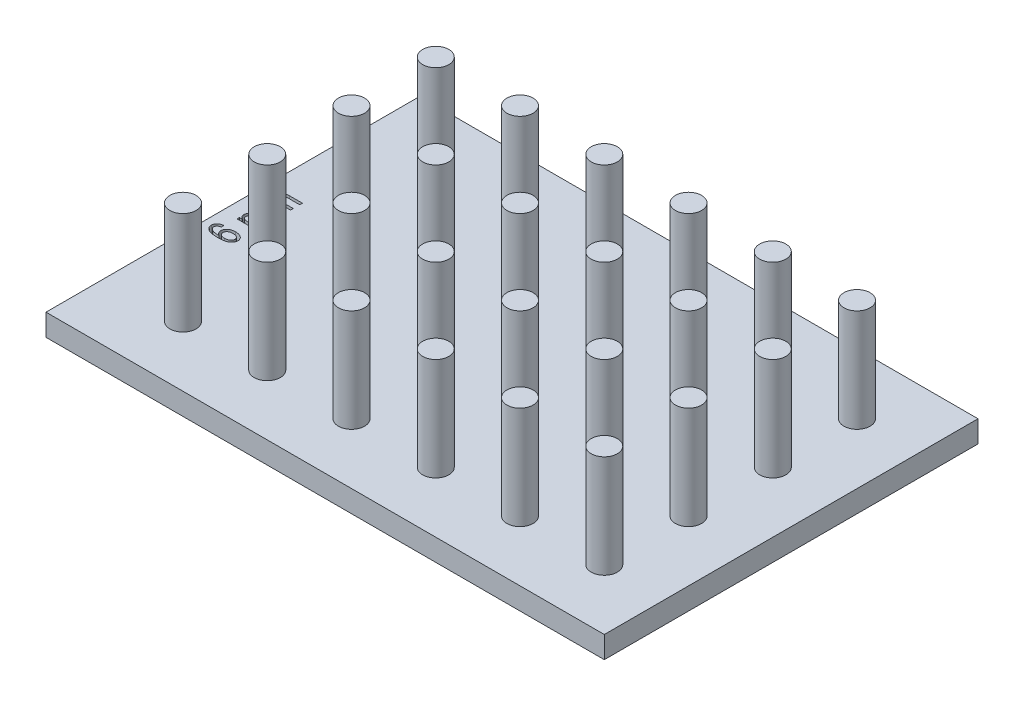
from build123d import *

# Parameters (mm, degrees)
SKETCH2_W            = 3
SKETCH2_H            = 23.5
SKETCH1_W            = 127.89
SKETCH1_H            = 85.6
BOSS_EXTRUDE2_DEPTH  = 5
LPATTERN2_COUNT      = 4
LPATTERN2_PITCH      = 19.3
LPATTERN2_COUNT_DIR2 = 6
LPATTERN2_PITCH_DIR2 = 19.3
CUT_EXTRUDE1_DEPTH   = 2


with BuildPart() as part:
    # Sketch2 → Revolve1 (revolve)
    with BuildSketch(Plane.XY.offset(-28.96), mode=Mode.PRIVATE) as revolve1_sk:
        with Locations((51.575, 11.75)):
            Rectangle(SKETCH2_W, SKETCH2_H)
    revolve1 = revolve(revolve1_sk.sketch.rotate(Axis((50.075, 23.5, -28.96), (0, -1, 0)), 90), axis=Axis((50.075, 23.5, -28.96), (0, -1, 0)))

    # Sketch1 → Boss-Extrude2 (add)
    with BuildSketch(Plane(origin=(0, 0, 0), x_dir=(1, 0, 0), z_dir=(0, 1, 0))):
        Rectangle(SKETCH1_W, SKETCH1_H)
    extrude(amount=-BOSS_EXTRUDE2_DEPTH)

    # LPattern2: Revolve1 4 × 6
    with Locations(*[(-j * LPATTERN2_PITCH_DIR2, 0, i * LPATTERN2_PITCH) for i in range(LPATTERN2_COUNT) for j in range(LPATTERN2_COUNT_DIR2) if (i, j) != (0, 0)]):
        add(revolve1)

    # Sketch5 → Cut-Extrude1 (cut)
    # profile 1 of 3: a face of its own
    with BuildSketch(Plane(origin=(0, 0, 0), x_dir=(1, 0, 0), z_dir=(0, 1, 0))):
        with BuildLine():
            Line((-56.194773063, 3.350649351), (-60.558409427, 3.350649351))
            Line((-60.558409427, 3.350649351), (-60.558409427, 3.896103896))
            Line((-60.558409427, 3.896103896), (-59.943555531, 3.896103896))
            add(Edge.make_bspline(
                [(-59.943555531, 3.896103896), (-59.996794447, 3.926822249), (-60.100876583, 3.98687666), (-60.239062939, 4.097881311), (-60.358476936, 4.22059706), (-60.45906551, 4.354856807), (-60.53843865, 4.499547799), (-60.594562214, 4.652256173), (-60.630633743, 4.811226722), (-60.634416703, 4.91985422), (-60.636331505, 4.974837662)],
                knots=[0, 0, 0, 0, 1.09277774, 2.136381581, 3.142818198, 4.133971442, 5.113525656, 6.068968217, 7.022579197, 8, 8, 8, 8], degree=3))
            add(Edge.make_bspline(
                [(-60.636331505, 4.974837662), (-60.634088382, 5.035494154), (-60.629756514, 5.152632593), (-60.593642069, 5.321259578), (-60.534033829, 5.474930057), (-60.449967949, 5.61337419), (-60.342936808, 5.735607446), (-60.212078766, 5.83806776), (-60.059955808, 5.922516148), (-59.947934839, 5.960743625), (-59.889984102, 5.980519481)],
                knots=[0, 0, 0, 0, 1.074449591, 2.074952659, 3.040944724, 3.983666911, 4.93191895, 5.905012228, 6.916220021, 8, 8, 8, 8], degree=3))
            add(Edge.make_bspline(
                [(-59.889984102, 5.980519481), (-59.949272949, 6.016197543), (-60.06335683, 6.084849441), (-60.215228096, 6.204663761), (-60.346217396, 6.329478457), (-60.452312831, 6.464895925), (-60.534399583, 6.608169484), (-60.59439712, 6.758742834), (-60.628882056, 6.917685108), (-60.633827602, 7.026218799), (-60.636331505, 7.081168831)],
                knots=[0, 0, 0, 0, 1.186540174, 2.283146265, 3.31266017, 4.285248268, 5.224385896, 6.137592124, 7.057072756, 8, 8, 8, 8], degree=3))
            add(Edge.make_bspline(
                [(-60.636331505, 7.081168831), (-60.635662931, 7.122634986), (-60.634352463, 7.203912646), (-60.616274438, 7.32203594), (-60.589881379, 7.433944926), (-60.55255542, 7.53886092), (-60.502559134, 7.636428764), (-60.443253099, 7.728007508), (-60.371944731, 7.8124882), (-60.289567405, 7.8898766), (-60.195568446, 7.959539048), (-60.088171681, 8.0200734), (-59.966788373, 8.068459489), (-59.834255708, 8.112168042), (-59.687932617, 8.142590305), (-59.529427595, 8.165975935), (-59.357322273, 8.17889705), (-59.238218024, 8.180821252), (-59.176510076, 8.181818182)],
                knots=[0, 0, 0, 0, 0.955498422, 1.872868982, 2.749207851, 3.604907424, 4.433768684, 5.272350985, 6.116089355, 6.976944253, 7.873691683, 8.808330241, 9.81133937, 10.882935648, 12.023104474, 13.252889189, 14.57672104, 16, 16, 16, 16], degree=3))
            Line((-59.176510076, 8.181818182), (-56.194773063, 8.181818182))
            Line((-56.194773063, 8.181818182), (-56.194773063, 7.558441558))
            Line((-56.194773063, 7.558441558), (-58.94152631, 7.558441558))
            add(Edge.make_bspline(
                [(-58.94152631, 7.558441558), (-59.013800725, 7.558158833), (-59.147135421, 7.55763725), (-59.33039957, 7.543765251), (-59.48020746, 7.525317134), (-59.599836599, 7.496119694), (-59.696209611, 7.456291357), (-59.778769772, 7.408121641), (-59.84883146, 7.346817558), (-59.908821132, 7.278106609), (-59.954925876, 7.201058055), (-59.988305286, 7.118957756), (-60.010143037, 7.032384914), (-60.01201268, 6.972532559), (-60.012954882, 6.94237013)],
                knots=[0, 0, 0, 0, 1.855735109, 3.42353348, 4.717873352, 5.729162317, 6.575113247, 7.388519106, 8.172054344, 8.955589582, 9.722515337, 10.465842131, 11.226865361, 12, 12, 12, 12], degree=3))
            add(Edge.make_bspline(
                [(-60.012954882, 6.94237013), (-60.0120605, 6.911461559), (-60.010296716, 6.850507632), (-59.995046391, 6.761103107), (-59.971459142, 6.675747526), (-59.935719712, 6.595687443), (-59.894436067, 6.518226441), (-59.83911388, 6.447813239), (-59.776745232, 6.379805077), (-59.704055196, 6.316710767), (-59.619767904, 6.26010977), (-59.525147467, 6.210572613), (-59.419123746, 6.168624023), (-59.30199092, 6.137127013), (-59.174505776, 6.109745853), (-59.035773633, 6.090589511), (-58.885691884, 6.07991367), (-58.782047121, 6.07860086), (-58.728458128, 6.077922078)],
                knots=[0, 0, 0, 0, 0.850256985, 1.676768018, 2.490111268, 3.280810737, 4.085979475, 4.899322724, 5.737306858, 6.624348552, 7.541552425, 8.52603189, 9.55919711, 10.673333412, 11.860946988, 13.147052635, 14.524898187, 16, 16, 16, 16], degree=3))
            Line((-58.728458128, 6.077922078), (-56.194773063, 6.077922078))
            Line((-56.194773063, 6.077922078), (-56.194773063, 5.454545455))
            Line((-56.194773063, 5.454545455), (-59.027971115, 5.454545455))
            add(Edge.make_bspline(
                [(-59.027971115, 5.454545455), (-59.071401885, 5.454068384), (-59.155082966, 5.453149179), (-59.275875268, 5.44643796), (-59.386249391, 5.432484013), (-59.487391484, 5.416281185), (-59.578154996, 5.393239636), (-59.659087752, 5.365698177), (-59.729626819, 5.332364937), (-59.809358656, 5.283392648), (-59.89132759, 5.209261406), (-59.961504189, 5.10165735), (-60.006879034, 4.979116167), (-60.010883285, 4.891241248), (-60.012954882, 4.845779221)],
                knots=[0, 0, 0, 0, 1.193618296, 2.299827258, 3.322171548, 4.249981195, 5.112908464, 5.892447954, 6.595906041, 7.252061334, 8.45997621, 9.595265847, 10.755912475, 12, 12, 12, 12], degree=3))
            add(Edge.make_bspline(
                [(-60.012954882, 4.845779221), (-60.012170325, 4.812836491), (-60.010639858, 4.748573773), (-59.994247841, 4.654897954), (-59.967610277, 4.566957444), (-59.930061932, 4.484375402), (-59.884467922, 4.405414987), (-59.824648938, 4.333858231), (-59.756461905, 4.266572122), (-59.677050321, 4.20426896), (-59.583162357, 4.148998621), (-59.47252185, 4.102007999), (-59.34520472, 4.062245673), (-59.200631396, 4.029684144), (-59.03910095, 4.004785241), (-58.860290467, 3.986773132), (-58.664469746, 3.975917289), (-58.527985697, 3.974673396), (-58.456948388, 3.974025974)],
                knots=[0, 0, 0, 0, 0.785764272, 1.532822213, 2.262268433, 2.973535088, 3.69469776, 4.431634212, 5.192142517, 5.97904095, 6.834803932, 7.785164623, 8.842330306, 10.015178037, 11.319777691, 12.741815971, 14.304178211, 16, 16, 16, 16], degree=3))
            Line((-58.456948388, 3.974025974), (-56.194773063, 3.974025974))
            Line((-56.194773063, 3.974025974), (-56.194773063, 3.350649351))
        make_face()
    # profile 2 of 3: a face of its own
    with BuildSketch(Plane(origin=(0, 0, 0), x_dir=(1, 0, 0), z_dir=(0, 1, 0))):
        with BuildLine():
            Line((-56.194773063, -2.415584416), (-60.558409427, -2.415584416))
            Line((-60.558409427, -2.415584416), (-60.558409427, -1.87012987))
            Line((-60.558409427, -1.87012987), (-59.943555531, -1.87012987))
            add(Edge.make_bspline(
                [(-59.943555531, -1.87012987), (-59.996794447, -1.839411517), (-60.100876583, -1.779357106), (-60.239062939, -1.668352455), (-60.358476936, -1.545636706), (-60.45906551, -1.411376959), (-60.53843865, -1.266685967), (-60.594562214, -1.113977593), (-60.630633743, -0.955007044), (-60.634416703, -0.846379547), (-60.636331505, -0.791396104)],
                knots=[0, 0, 0, 0, 1.09277774, 2.136381581, 3.142818198, 4.133971442, 5.113525656, 6.068968217, 7.022579197, 8, 8, 8, 8], degree=3))
            add(Edge.make_bspline(
                [(-60.636331505, -0.791396104), (-60.634088382, -0.730739612), (-60.629756514, -0.613601173), (-60.593642069, -0.444974188), (-60.534033829, -0.29130371), (-60.449967949, -0.152859576), (-60.342936808, -0.03062632), (-60.212078766, 0.071833994), (-60.059955808, 0.156282382), (-59.947934839, 0.194509859), (-59.889984102, 0.214285714)],
                knots=[0, 0, 0, 0, 1.074449591, 2.074952659, 3.040944724, 3.983666911, 4.93191895, 5.905012228, 6.916220021, 8, 8, 8, 8], degree=3))
            add(Edge.make_bspline(
                [(-59.889984102, 0.214285714), (-59.949272949, 0.249963777), (-60.06335683, 0.318615674), (-60.215228096, 0.438429995), (-60.346217396, 0.563244691), (-60.452312831, 0.698662159), (-60.534399583, 0.841935718), (-60.59439712, 0.992509068), (-60.628882056, 1.151451342), (-60.633827602, 1.259985032), (-60.636331505, 1.314935065)],
                knots=[0, 0, 0, 0, 1.186540174, 2.283146265, 3.31266017, 4.285248268, 5.224385896, 6.137592124, 7.057072756, 8, 8, 8, 8], degree=3))
            add(Edge.make_bspline(
                [(-60.636331505, 1.314935065), (-60.635662931, 1.35640122), (-60.634352463, 1.43767888), (-60.616274438, 1.555802173), (-60.589881379, 1.66771116), (-60.55255542, 1.772627154), (-60.502559134, 1.870194997), (-60.443253099, 1.961773742), (-60.371944731, 2.046254434), (-60.289567405, 2.123642834), (-60.195568446, 2.193305281), (-60.088171681, 2.253839634), (-59.966788373, 2.302225723), (-59.834255708, 2.345934275), (-59.687932617, 2.376356539), (-59.529427595, 2.399742169), (-59.357322273, 2.412663284), (-59.238218024, 2.414587486), (-59.176510076, 2.415584416)],
                knots=[0, 0, 0, 0, 0.955498422, 1.872868982, 2.749207851, 3.604907424, 4.433768684, 5.272350985, 6.116089355, 6.976944253, 7.873691683, 8.808330241, 9.81133937, 10.882935648, 12.023104474, 13.252889189, 14.57672104, 16, 16, 16, 16], degree=3))
            Line((-59.176510076, 2.415584416), (-56.194773063, 2.415584416))
            Line((-56.194773063, 2.415584416), (-56.194773063, 1.792207792))
            Line((-56.194773063, 1.792207792), (-58.94152631, 1.792207792))
            add(Edge.make_bspline(
                [(-58.94152631, 1.792207792), (-59.013800725, 1.791925067), (-59.147135421, 1.791403484), (-59.33039957, 1.777531485), (-59.48020746, 1.759083367), (-59.599836599, 1.729885927), (-59.696209611, 1.690057591), (-59.778769772, 1.641887875), (-59.84883146, 1.580583792), (-59.908821132, 1.511872843), (-59.954925876, 1.434824288), (-59.988305286, 1.35272399), (-60.010143037, 1.266151148), (-60.01201268, 1.206298793), (-60.012954882, 1.176136364)],
                knots=[0, 0, 0, 0, 1.855735109, 3.42353348, 4.717873352, 5.729162317, 6.575113247, 7.388519106, 8.172054344, 8.955589582, 9.722515337, 10.465842131, 11.226865361, 12, 12, 12, 12], degree=3))
            add(Edge.make_bspline(
                [(-60.012954882, 1.176136364), (-60.0120605, 1.145227793), (-60.010296716, 1.084273866), (-59.995046391, 0.994869341), (-59.971459142, 0.90951376), (-59.935719712, 0.829453677), (-59.894436067, 0.751992675), (-59.83911388, 0.681579472), (-59.776745232, 0.613571311), (-59.704055196, 0.550477001), (-59.619767904, 0.493876004), (-59.525147467, 0.444338847), (-59.419123746, 0.402390256), (-59.30199092, 0.370893247), (-59.174505776, 0.343512087), (-59.035773633, 0.324355745), (-58.885691884, 0.313679903), (-58.782047121, 0.312367093), (-58.728458128, 0.311688312)],
                knots=[0, 0, 0, 0, 0.850256985, 1.676768018, 2.490111268, 3.280810737, 4.085979475, 4.899322724, 5.737306858, 6.624348552, 7.541552425, 8.52603189, 9.55919711, 10.673333412, 11.860946988, 13.147052635, 14.524898187, 16, 16, 16, 16], degree=3))
            Line((-58.728458128, 0.311688312), (-56.194773063, 0.311688312))
            Line((-56.194773063, 0.311688312), (-56.194773063, -0.311688312))
            Line((-56.194773063, -0.311688312), (-59.027971115, -0.311688312))
            add(Edge.make_bspline(
                [(-59.027971115, -0.311688312), (-59.071401885, -0.312165382), (-59.155082966, -0.313084587), (-59.275875268, -0.319795806), (-59.386249391, -0.333749753), (-59.487391484, -0.349952581), (-59.578154996, -0.372994131), (-59.659087752, -0.40053559), (-59.729626819, -0.433868829), (-59.809358656, -0.482841118), (-59.89132759, -0.55697236), (-59.961504189, -0.664576416), (-60.006879034, -0.787117599), (-60.010883285, -0.874992518), (-60.012954882, -0.920454545)],
                knots=[0, 0, 0, 0, 1.193618296, 2.299827258, 3.322171548, 4.249981195, 5.112908464, 5.892447954, 6.595906041, 7.252061334, 8.45997621, 9.595265847, 10.755912475, 12, 12, 12, 12], degree=3))
            add(Edge.make_bspline(
                [(-60.012954882, -0.920454545), (-60.012170325, -0.953397275), (-60.010639858, -1.017659993), (-59.994247841, -1.111335812), (-59.967610277, -1.199276323), (-59.930061932, -1.281858364), (-59.884467922, -1.360818779), (-59.824648938, -1.432375535), (-59.756461905, -1.499661645), (-59.677050321, -1.561964806), (-59.583162357, -1.617235145), (-59.47252185, -1.664225768), (-59.34520472, -1.703988094), (-59.200631396, -1.736549622), (-59.03910095, -1.761448526), (-58.860290467, -1.779460634), (-58.664469746, -1.790316478), (-58.527985697, -1.79156037), (-58.456948388, -1.792207792)],
                knots=[0, 0, 0, 0, 0.785764272, 1.532822213, 2.262268433, 2.973535088, 3.69469776, 4.431634212, 5.192142517, 5.97904095, 6.834803932, 7.785164623, 8.842330306, 10.015178037, 11.319777691, 12.741815971, 14.304178211, 16, 16, 16, 16], degree=3))
            Line((-58.456948388, -1.792207792), (-56.194773063, -1.792207792))
            Line((-56.194773063, -1.792207792), (-56.194773063, -2.415584416))
        make_face()
    # profile 3 of 3: a face of its own
    with BuildSketch(Plane(origin=(0, 0, 0), x_dir=(1, 0, 0), z_dir=(0, 1, 0))):
        with BuildLine():
            Line((-60.792175661, -5.220779221), (-60.714253583, -5.844155844))
            add(Edge.make_bspline(
                [(-60.714253583, -5.844155844), (-60.785249682, -5.858565154), (-60.918192866, -5.885547193), (-61.098288758, -5.944070924), (-61.248866279, -6.009277176), (-61.328764668, -6.069577335), (-61.365633453, -6.097402597)],
                knots=[0, 0, 0, 0, 1.230211225, 2.30362229, 3.217213433, 4, 4, 4, 4], degree=3))
            add(Edge.make_bspline(
                [(-61.365633453, -6.097402597), (-61.388410066, -6.117637662), (-61.432697383, -6.156983138), (-61.490065605, -6.222375486), (-61.539507632, -6.289702263), (-61.58021754, -6.360505212), (-61.61065458, -6.435618964), (-61.632440171, -6.51364522), (-61.646328837, -6.594480791), (-61.648316036, -6.649295616), (-61.649318518, -6.676948052)],
                knots=[0, 0, 0, 0, 1.09495211, 2.12904747, 3.12182315, 4.09596367, 5.058329339, 6.028853599, 7.005615717, 8, 8, 8, 8], degree=3))
            add(Edge.make_bspline(
                [(-61.649318518, -6.676948052), (-61.647729096, -6.719786206), (-61.644580132, -6.804657211), (-61.610631166, -6.927822853), (-61.559655114, -7.045076379), (-61.48592932, -7.15477776), (-61.392061183, -7.257136243), (-61.278936122, -7.354330168), (-61.143957369, -7.442704055), (-61.044706348, -7.494006612), (-60.993068518, -7.520698052)],
                knots=[0, 0, 0, 0, 0.906800098, 1.796553483, 2.691003266, 3.610512055, 4.585978966, 5.630213089, 6.767058994, 8, 8, 8, 8], degree=3))
            add(Edge.make_bspline(
                [(-60.993068518, -7.520698052), (-60.943503823, -7.543099762), (-60.840457741, -7.589673405), (-60.6725331, -7.644288034), (-60.488485934, -7.692281364), (-60.28670922, -7.728267537), (-60.069293587, -7.760984812), (-59.8343039, -7.781844935), (-59.582923136, -7.795478488), (-59.409484482, -7.79733798), (-59.320178908, -7.798295455)],
                knots=[0, 0, 0, 0, 0.763508889, 1.587351645, 2.476402758, 3.433472996, 4.464603951, 5.563935012, 6.745641893, 8, 8, 8, 8], degree=3))
            add(Edge.make_bspline(
                [(-59.320178908, -7.798295455), (-59.380941264, -7.762993612), (-59.499172948, -7.694303119), (-59.654204497, -7.566399453), (-59.789037353, -7.428734824), (-59.898912156, -7.277109074), (-59.984257306, -7.116123998), (-60.04552492, -6.949456148), (-60.083997745, -6.778127091), (-60.088577747, -6.662128639), (-60.090876959, -6.603896104)],
                knots=[0, 0, 0, 0, 1.127689085, 2.194262806, 3.218345157, 4.217743143, 5.19231177, 6.137448631, 7.064978137, 8, 8, 8, 8], degree=3))
            add(Edge.make_bspline(
                [(-60.090876959, -6.603896104), (-60.089193459, -6.55549954), (-60.085875387, -6.460113018), (-60.060764956, -6.31935521), (-60.019007195, -6.183854138), (-59.961578425, -6.052352116), (-59.886054743, -5.926156229), (-59.794818391, -5.80437068), (-59.685983146, -5.688523675), (-59.564294352, -5.576586772), (-59.427218313, -5.474971955), (-59.277886745, -5.385847569), (-59.117863913, -5.309796126), (-58.945733044, -5.249434966), (-58.763540348, -5.200490972), (-58.569626292, -5.166516645), (-58.364801039, -5.147480957), (-58.224438943, -5.144422998), (-58.152565271, -5.142857143)],
                knots=[0, 0, 0, 0, 0.860357646, 1.695709716, 2.533583491, 3.377064945, 4.241047709, 5.143225219, 6.077846286, 7.063889573, 8.080111547, 9.106229702, 10.152257742, 11.225204373, 12.345649275, 13.503769734, 14.721782881, 16, 16, 16, 16], degree=3))
            add(Edge.make_bspline(
                [(-58.152565271, -5.142857143), (-58.055027509, -5.145343268), (-57.863961523, -5.150213321), (-57.58420831, -5.191018518), (-57.318851015, -5.259748096), (-57.108492769, -5.337561578), (-56.950925409, -5.412496784), (-56.840922163, -5.471873715), (-56.739481985, -5.536169862), (-56.644006535, -5.601675071), (-56.559303272, -5.674780117), (-56.480087028, -5.748498603), (-56.410894601, -5.828337267), (-56.328923472, -5.937581807), (-56.242999134, -6.081120993), (-56.170882265, -6.265524313), (-56.125008307, -6.457989429), (-56.11958328, -6.58984262), (-56.116850985, -6.65625)],
                knots=[0, 0, 0, 0, 1.657594599, 3.247049531, 4.793269837, 6.310589185, 7.051271314, 7.758283223, 8.434037218, 9.092523529, 9.724148541, 10.334150818, 10.930619913, 11.517069014, 12.655365671, 13.76103642, 14.872354135, 16, 16, 16, 16], degree=3))
            add(Edge.make_bspline(
                [(-56.116850985, -6.65625), (-56.118951647, -6.716057794), (-56.123083345, -6.833691056), (-56.155983765, -7.005909985), (-56.208199344, -7.170115115), (-56.282253451, -7.326545366), (-56.377919567, -7.47478948), (-56.49601221, -7.613568288), (-56.634003416, -7.744806126), (-56.792598989, -7.868756024), (-56.977500024, -7.980195624), (-57.189310729, -8.077437263), (-57.429744989, -8.158675574), (-57.698222336, -8.222686752), (-57.994134795, -8.275191219), (-58.317769759, -8.312103292), (-58.669714855, -8.333832036), (-58.913490479, -8.336352702), (-59.04014644, -8.337662338)],
                knots=[0, 0, 0, 0, 0.76079261, 1.49636878, 2.22335124, 2.948937493, 3.692613516, 4.462506464, 5.262670056, 6.113081641, 7.019393936, 8.004001644, 9.074018115, 10.244225697, 11.513927426, 12.897326774, 14.387976403, 16, 16, 16, 16], degree=3))
            add(Edge.make_bspline(
                [(-59.04014644, -8.337662338), (-59.180607686, -8.336509764), (-59.451184509, -8.334289508), (-59.841530004, -8.31045114), (-60.200588522, -8.274391695), (-60.5282034, -8.220653331), (-60.824961161, -8.154080888), (-61.090388597, -8.06984635), (-61.325886175, -7.973151581), (-61.528964453, -7.856898193), (-61.704159582, -7.729758795), (-61.854912106, -7.593604911), (-61.984769101, -7.450798416), (-62.090579145, -7.297910809), (-62.171345219, -7.135161374), (-62.230849201, -6.964853489), (-62.265305613, -6.785062308), (-62.270206724, -6.662481075), (-62.272695141, -6.600243506)],
                knots=[0, 0, 0, 0, 1.648729313, 3.176021509, 4.589257728, 5.883210501, 7.07130447, 8.156186091, 9.149022935, 10.053769316, 10.896205842, 11.685573168, 12.434569159, 13.157455576, 13.86058765, 14.561213295, 15.269491877, 16, 16, 16, 16], degree=3))
            add(Edge.make_bspline(
                [(-62.272695141, -6.600243506), (-62.271411706, -6.55515224), (-62.268881805, -6.466268542), (-62.252276946, -6.335500514), (-62.221281443, -6.210911925), (-62.17948878, -6.091996053), (-62.127643445, -5.977723853), (-62.060973262, -5.870739), (-61.983693036, -5.768677832), (-61.89480313, -5.672881216), (-61.795055792, -5.583096468), (-61.682178801, -5.504627433), (-61.559985363, -5.433833745), (-61.427572343, -5.370984794), (-61.283864892, -5.319247695), (-61.129457798, -5.276977218), (-60.964877576, -5.242223875), (-60.850751464, -5.228052666), (-60.792175661, -5.220779221)],
                knots=[0, 0, 0, 0, 0.965466884, 1.903123866, 2.815643703, 3.708762019, 4.59904389, 5.49616866, 6.401586744, 7.336219343, 8.290161022, 9.268947462, 10.273430203, 11.311221761, 12.402489703, 13.538768752, 14.73676065, 16, 16, 16, 16], degree=3))
        make_face()
        with BuildLine():
            add(Edge.make_bspline(
                [(-58.175698388, -7.714285714), (-58.122906317, -7.713391472), (-58.019951414, -7.711647524), (-57.869358791, -7.696875069), (-57.726752133, -7.67212067), (-57.591311667, -7.640700706), (-57.465276071, -7.595503515), (-57.345933196, -7.543841167), (-57.235509958, -7.480085801), (-57.133121421, -7.408498627), (-57.041665248, -7.330284291), (-56.961610808, -7.247764127), (-56.892892538, -7.163188114), (-56.83774938, -7.074070788), (-56.792801031, -6.982776041), (-56.762869269, -6.887024792), (-56.743647486, -6.788921298), (-56.741371086, -6.722492005), (-56.740227609, -6.689123377)],
                knots=[0, 0, 0, 0, 1.295915113, 2.527288866, 3.709970359, 4.848208075, 5.935365449, 6.992568332, 8.036874269, 9.05966364, 10.056099687, 10.986214356, 11.87941223, 12.725402229, 13.554321318, 14.370446187, 15.18144582, 16, 16, 16, 16], degree=3))
            add(Edge.make_bspline(
                [(-56.740227609, -6.689123377), (-56.741506697, -6.659427454), (-56.744050819, -6.600361872), (-56.761169699, -6.513260556), (-56.791533534, -6.429426407), (-56.831580779, -6.347237642), (-56.884752928, -6.267776988), (-56.949364201, -6.191093288), (-57.026273447, -6.118152947), (-57.111563066, -6.045835461), (-57.209013197, -5.981517199), (-57.313597962, -5.92127333), (-57.429482757, -5.875339565), (-57.552261833, -5.834069514), (-57.685067207, -5.804823281), (-57.825492226, -5.780714103), (-57.975443154, -5.769620555), (-58.077879232, -5.76738528), (-58.130649687, -5.766233766)],
                knots=[0, 0, 0, 0, 0.772713955, 1.536938285, 2.298458163, 3.087170851, 3.910203315, 4.779624773, 5.690759825, 6.665637977, 7.684919877, 8.72499675, 9.799719792, 10.921806825, 12.09248587, 13.333813582, 14.6265008, 16, 16, 16, 16], degree=3))
            add(Edge.make_bspline(
                [(-58.130649687, -5.766233766), (-58.18221084, -5.767338067), (-58.282231456, -5.769480237), (-58.428371525, -5.781197035), (-58.565079542, -5.802991103), (-58.693557904, -5.833243033), (-58.812186429, -5.873650683), (-58.923300943, -5.920731676), (-59.024556717, -5.978508251), (-59.116948412, -6.043596761), (-59.198130396, -6.116201351), (-59.271338001, -6.190896673), (-59.33017239, -6.272391018), (-59.382019469, -6.355138733), (-59.418862859, -6.443974876), (-59.448115541, -6.535755614), (-59.463317857, -6.632214648), (-59.466099897, -6.697603606), (-59.467500336, -6.730519481)],
                knots=[0, 0, 0, 0, 1.34413917, 2.607420863, 3.817865127, 4.949372023, 6.043265408, 7.080878207, 8.089894499, 9.076140083, 10.020536592, 10.925912695, 11.795477937, 12.63545564, 13.464706931, 14.294565263, 15.141508349, 16, 16, 16, 16], degree=3))
            add(Edge.make_bspline(
                [(-59.467500336, -6.730519481), (-59.466825548, -6.763080588), (-59.46549145, -6.827455825), (-59.446960945, -6.921581534), (-59.420847276, -7.01320098), (-59.380688321, -7.100729093), (-59.332315587, -7.186547002), (-59.272017906, -7.268477125), (-59.200485222, -7.346593494), (-59.119580574, -7.42181743), (-59.028957382, -7.49080903), (-58.929539199, -7.551173585), (-58.822052144, -7.600345577), (-58.707776354, -7.642309283), (-58.585621237, -7.675254982), (-58.455619505, -7.697896474), (-58.318028829, -7.711392006), (-58.224025102, -7.713303188), (-58.175698388, -7.714285714)],
                knots=[0, 0, 0, 0, 0.863336265, 1.706866888, 2.538958102, 3.388184842, 4.257154246, 5.151813003, 6.08274342, 7.06663784, 8.081968542, 9.102321145, 10.14869887, 11.215962244, 12.332381785, 13.503694224, 14.716665185, 16, 16, 16, 16], degree=3))
        make_face(mode=Mode.SUBTRACT)
    extrude(amount=-CUT_EXTRUDE1_DEPTH, mode=Mode.SUBTRACT)


solid = part.part
